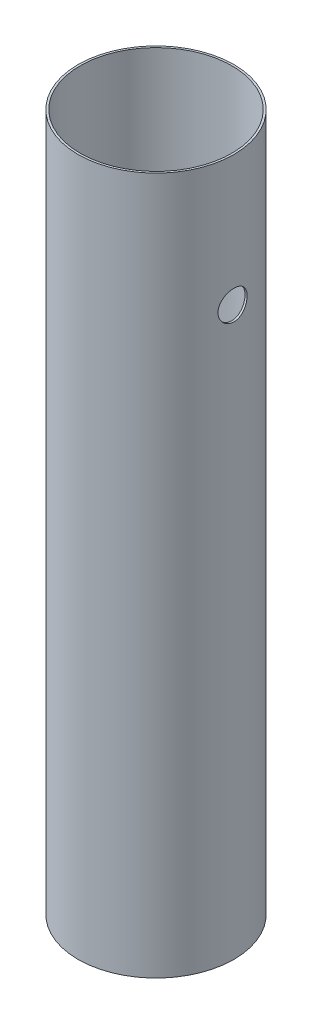
from build123d import *

# Parameters (mm, degrees)
CROQUIS1_R              = 57
CROQUIS1_R_2            = 55.5
SALIENTE_EXTRUIR1_DEPTH = 510
CROQUIS2_R              = 10.65
CORTAR_EXTRUIR1_DEPTH   = 10


with BuildPart() as part:
    # Croquis1 → Saliente-Extruir1 (new body)
    with BuildSketch(Plane(origin=(0, 0, 0), x_dir=(1, 0, 0), z_dir=(0, 1, 0))):
        with Locations(Location((0, 0, 0), (0, 0, 270))):
            Circle(CROQUIS1_R)
        with Locations(Location((0, 0, 0), (0, 0, 270))):
            Circle(CROQUIS1_R_2, mode=Mode.SUBTRACT)
    extrude(amount=SALIENTE_EXTRUIR1_DEPTH)

    # Croquis2 → Cortar-Extruir1 (cut)
    with BuildSketch(Plane(origin=(57, 0, 0), x_dir=(0, 0, -1), z_dir=(1, 0, 0))):
        with Locations((0, 414.6)):
            Circle(CROQUIS2_R)
    extrude(amount=-CORTAR_EXTRUIR1_DEPTH, mode=Mode.SUBTRACT)


solid = part.part
